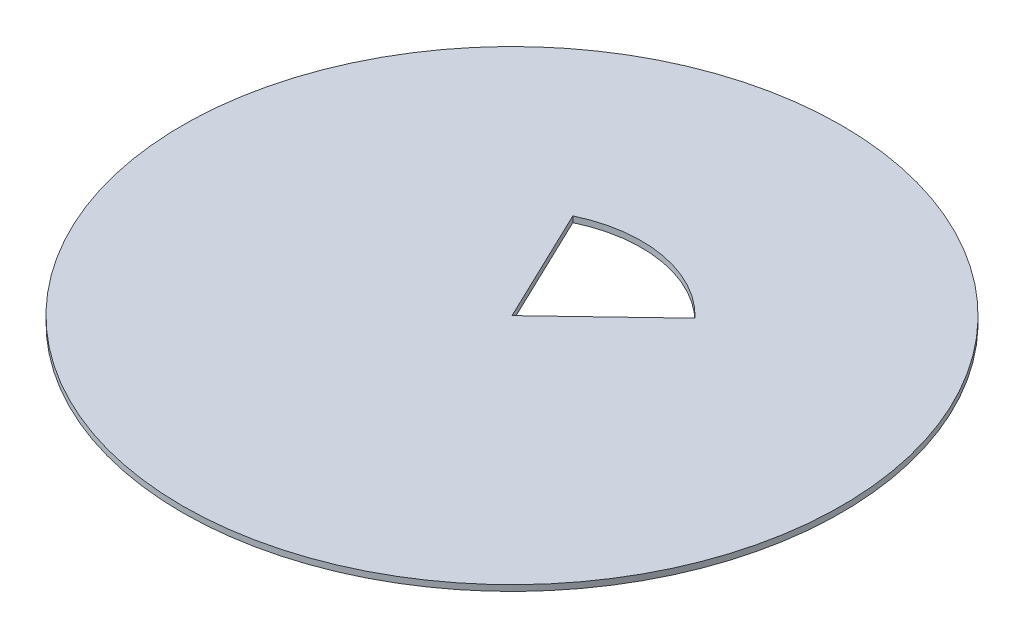
from build123d import *

# Parameters (mm, degrees)
SKETCH1_R           = 177.8
BOSS_EXTRUDE1_DEPTH = 3.175
CUT_EXTRUDE1_REACH  = 253.467


with BuildPart() as part:
    # Sketch1 → Boss-Extrude1 (new body)
    with BuildSketch(Plane(origin=(0, 0, 0), x_dir=(1, 0, 0), z_dir=(0, 1, 0))):
        with Locations(Location((0, 0, 0), (0, 0, 270))):
            Circle(SKETCH1_R)
    extrude(amount=BOSS_EXTRUDE1_DEPTH)

    # Sketch3 → Cut-Extrude1 (cut, up to next)
    with BuildSketch(Plane(origin=(0, 3.175, 0), x_dir=(1, 0, 0), z_dir=(0, 1, 0)), mode=Mode.PRIVATE) as cut_extrude1_sk1:
        with BuildLine():
            Line((-30.171620542, 62.997585778), (0, 0))
            Line((0, 0), (50.59072097, 48.162240933))
            ThreePointArc((50.59072097, 48.162240933), (12.619698084, 68.700551091), (-30.171620542, 62.997585778))
        make_face()
    cut_extrude1_tool1 = extrude(cut_extrude1_sk1.sketch, amount=-CUT_EXTRUDE1_REACH, mode=Mode.PRIVATE) & part.part
    add(cut_extrude1_tool1.solids().sort_by_distance((7.870395, 3.175, -42.845753))[0], mode=Mode.SUBTRACT)


solid = part.part
